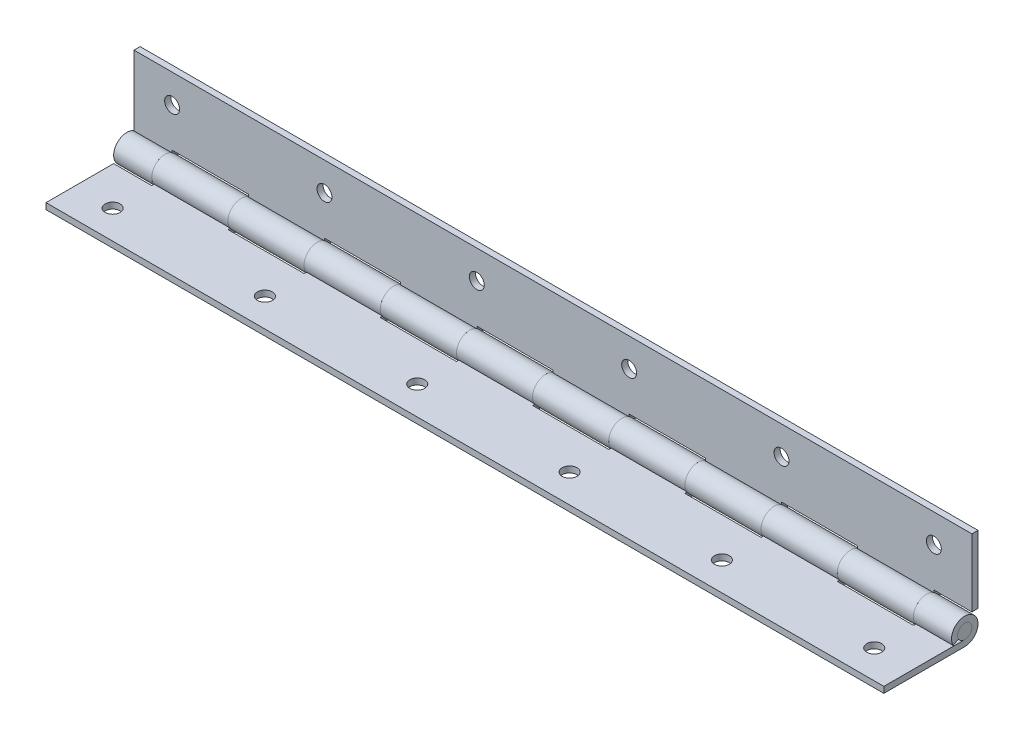
from build123d import *

# Parameters (mm, degrees)
BOSS_EXTRUDE1_DEPTH = 139.7
SKETCH2_R           = 1.2446
CUT_EXTRUDE1_DEPTH  = 141.39082752
LPATTERN1_COUNT     = 6
LPATTERN1_PITCH     = 25.4
SKETCH3_W           = 6.35
SKETCH3_H           = 4.4196
SKETCH3_W_2         = 12.7
CUT_EXTRUDE2_DEPTH  = 142.224650988
SKETCH4_W           = 12.7
SKETCH4_H           = 4.4196
SKETCH4_W_2         = 6.35
CUT_EXTRUDE3_DEPTH  = 142.224650988
SKETCH5_R           = 1.1938
BOSS_EXTRUDE2_DEPTH = 139.7


with BuildPart() as part:
    # Sketch1 → Boss-Extrude1 (new body)
    with BuildSketch(Plane(origin=(0, 0, 0), x_dir=(0, 0, -1), z_dir=(1, 0, 0))):
        with BuildLine():
            Line((0, -2.2098), (-13.4874, -2.2098))
            Line((-13.4874, -2.2098), (-13.4874, -1.1938))
            Line((-13.4874, -1.1938), (0, -1.1938))
            ThreePointArc((0, -1.1938), (0.607104158, 1.027902224), (-1.045474475, -0.576317241))
            Line((-1.045474475, -0.576317241), (-1.935239985, -1.0668))
            ThreePointArc((-1.935239985, -1.0668), (1.123788548, 1.902712627), (0, -2.2098))
        make_face()
    extrude(amount=BOSS_EXTRUDE1_DEPTH)

    # Sketch2 → Cut-Extrude1 (cut, through all)
    with BuildSketch(Plane(origin=(0, -1.1938, 0), x_dir=(1, 0, 0), z_dir=(0, 1, 0))):
        with Locations(Location((6.35, -8.7376, 0), (0, 0, 270))):
            Circle(SKETCH2_R)
    cut_extrude1 = extrude(amount=-CUT_EXTRUDE1_DEPTH, mode=Mode.SUBTRACT)

    # LPattern1: Cut-Extrude1 ×6
    with Locations(*[(i * LPATTERN1_PITCH, 0, 0) for i in range(1, LPATTERN1_COUNT)]):
        add(cut_extrude1, mode=Mode.SUBTRACT)


with BuildPart() as body_2:
    # Mirror1: mirrored copy
    add(part.part.mirror(Plane(origin=(0, 0, 0), x_dir=(0, 0.7071067811865477, 0.7071067811865474), z_dir=(0, 0.7071067811865476, -0.7071067811865476))))

    # Sketch4 → Cut-Extrude3 (cut, through all)
    with BuildSketch(Plane(origin=(0, 0, -2.2098), x_dir=(-1, 0, 0), z_dir=(0, 0, -1))):
        with Locations((-12.7, 0)):
            Rectangle(SKETCH4_W, SKETCH4_H)
        with Locations((-38.1, 0)):
            Rectangle(SKETCH4_W, SKETCH4_H)
        with Locations((-63.5, 0)):
            Rectangle(SKETCH4_W, SKETCH4_H)
        with Locations((-88.9, 0)):
            Rectangle(SKETCH4_W, SKETCH4_H)
        with Locations((-114.3, 0)):
            Rectangle(SKETCH4_W, SKETCH4_H)
        with Locations((-136.525, 0)):
            Rectangle(SKETCH4_W_2, SKETCH4_H)
    extrude(amount=-CUT_EXTRUDE3_DEPTH, mode=Mode.SUBTRACT)


with BuildPart() as part_1:
    add(part.part)

    # Sketch3 → Cut-Extrude2 (cut, through all)
    with BuildSketch(Plane.XZ.offset(2.2098)):
        with Locations((3.175, 0)):
            Rectangle(SKETCH3_W, SKETCH3_H)
        with Locations((25.4, 0)):
            Rectangle(SKETCH3_W_2, SKETCH3_H)
        with Locations((50.8, 0)):
            Rectangle(SKETCH3_W_2, SKETCH3_H)
        with Locations((76.2, 0)):
            Rectangle(SKETCH3_W_2, SKETCH3_H)
        with Locations((101.6, 0)):
            Rectangle(SKETCH3_W_2, SKETCH3_H)
        with Locations((127, 0)):
            Rectangle(SKETCH3_W_2, SKETCH3_H)
    extrude(amount=-CUT_EXTRUDE2_DEPTH, mode=Mode.SUBTRACT)


with BuildPart() as body_3:
    # Sketch5 → Boss-Extrude2 (new body)
    with BuildSketch(Plane.ZY):
        Circle(SKETCH5_R)
    extrude(amount=-BOSS_EXTRUDE2_DEPTH)


solid = Compound([body_2.part, part_1.part, body_3.part])
